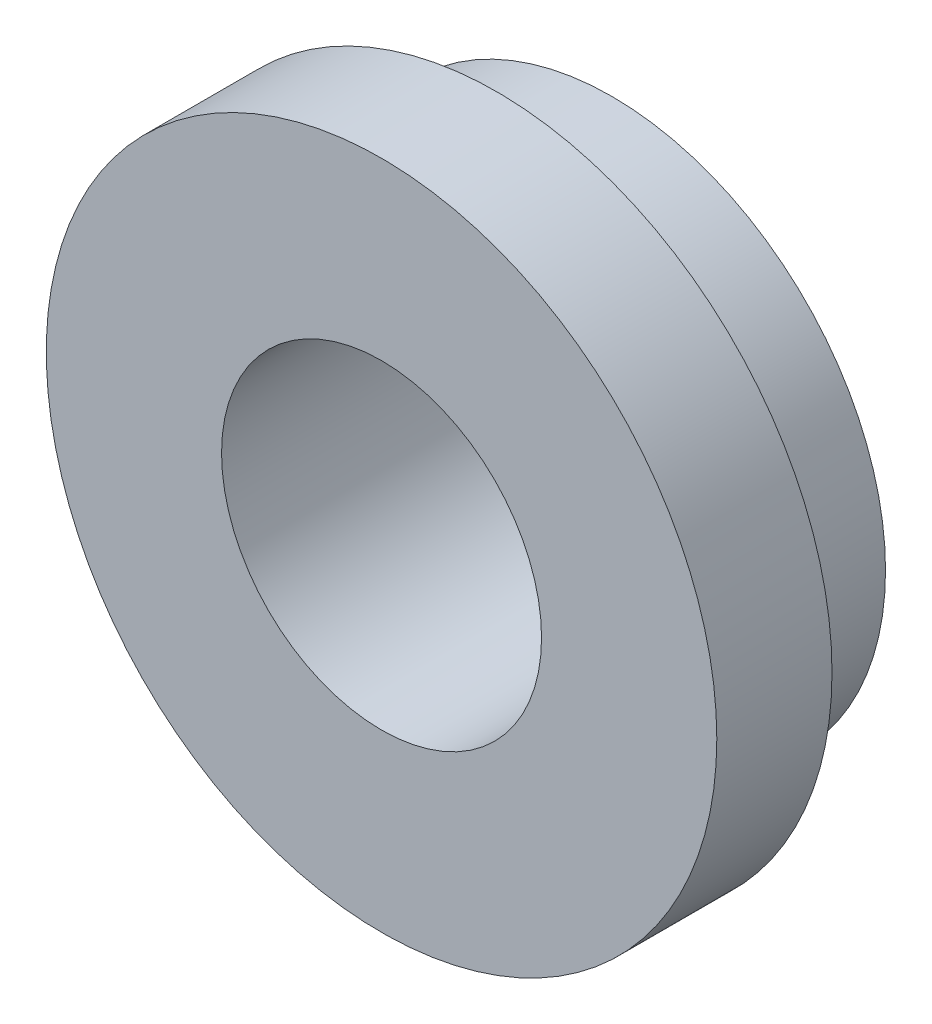
from build123d import *

# Parameters (mm, degrees)
SKETCH1_R               = 14.25
BOSS_EXTRUDE1_DEPTH     = 6
SKETCH2_R               = 17.4625
BOSS_EXTRUDE2_DEPTH     = 6
F_5_8_CLEARANCE_HOLE1_D = 16.66748


with BuildPart() as part:
    # Sketch1 → Boss-Extrude1 (new body)
    with BuildSketch(Plane.XY):
        Circle(SKETCH1_R)
    extrude(amount=BOSS_EXTRUDE1_DEPTH)

    # Sketch2 → Boss-Extrude2 (add)
    with BuildSketch(Plane.XY.offset(6)):
        Circle(SKETCH2_R)
    extrude(amount=BOSS_EXTRUDE2_DEPTH)

    # 5/8 Clearance Hole1 (through all)
    with Locations(Plane.XY.offset(12)):
        with Locations((0, 0)):
            Hole(F_5_8_CLEARANCE_HOLE1_D / 2)


solid = part.part
